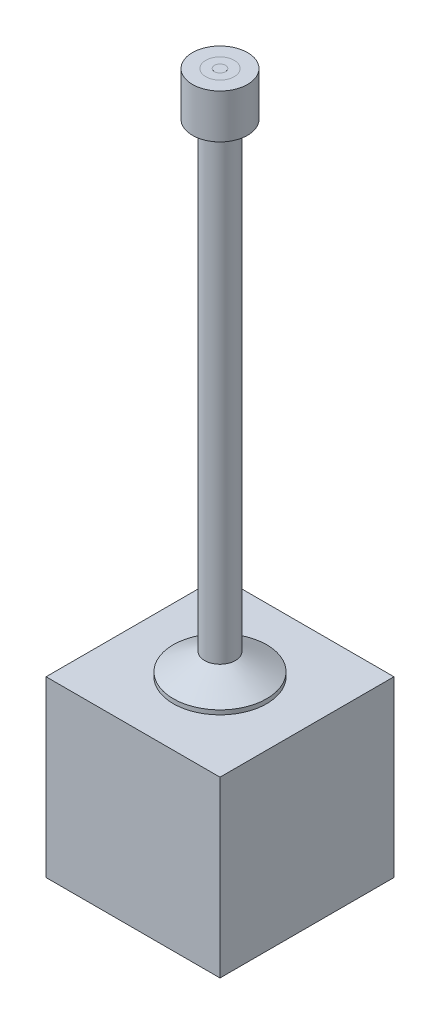
from build123d import *

# Parameters (mm, degrees)
CROQUIS4_W              = 20
CROQUIS4_H              = 20
SALIENTE_EXTRUIR1_DEPTH = 20


with BuildPart() as part:
    # Croquis1 → Revolución1 (revolve)
    with BuildSketch(Plane.XY, mode=Mode.PRIVATE) as revoluci_n1_sk:
        Polygon((5.375, 0), (5.375, 0.5), (1.78, 2.5), (1.78, 54.5), (3.171785891, 55.5), (3.171785891, 60.571), (1.635, 60.571), (1.375, 54.942193309), (1.375, 0), align=None)
        Polygon((0.375, 0), (0.375, 54.942193309), (0.635, 60.571), (0.442390715, 60.571), (0, 60.571), (0, 0), align=None)
    revolve(revoluci_n1_sk.sketch.rotate(Axis((0, 60.571, 0), (0, -1, 0)), 180), axis=Axis((0, 60.571, 0), (0, -1, 0)))


with BuildPart() as body_2:
    # Croquis3 → Revolución2 (revolve)
    with BuildSketch(Plane.XY, mode=Mode.PRIVATE) as revoluci_n2_sk:
        Polygon((0.375, 54.942193309), (0.635, 60.571), (1.635, 60.571), (1.375, 54.942193309), (1.375, 0), (0.375, 0), align=None)
    revolve(revoluci_n2_sk.sketch.rotate(Axis((0, 55.5, 0), (0, -1, 0)), 90), axis=Axis((0, 55.5, 0), (0, -1, 0)))


with BuildPart() as body_3:
    # Croquis4 → Saliente-Extruir1 (new body)
    with BuildSketch(Plane.XZ):
        Rectangle(CROQUIS4_W, CROQUIS4_H)
    extrude(amount=SALIENTE_EXTRUIR1_DEPTH)


solid = Compound([part.part, body_2.part, body_3.part])
